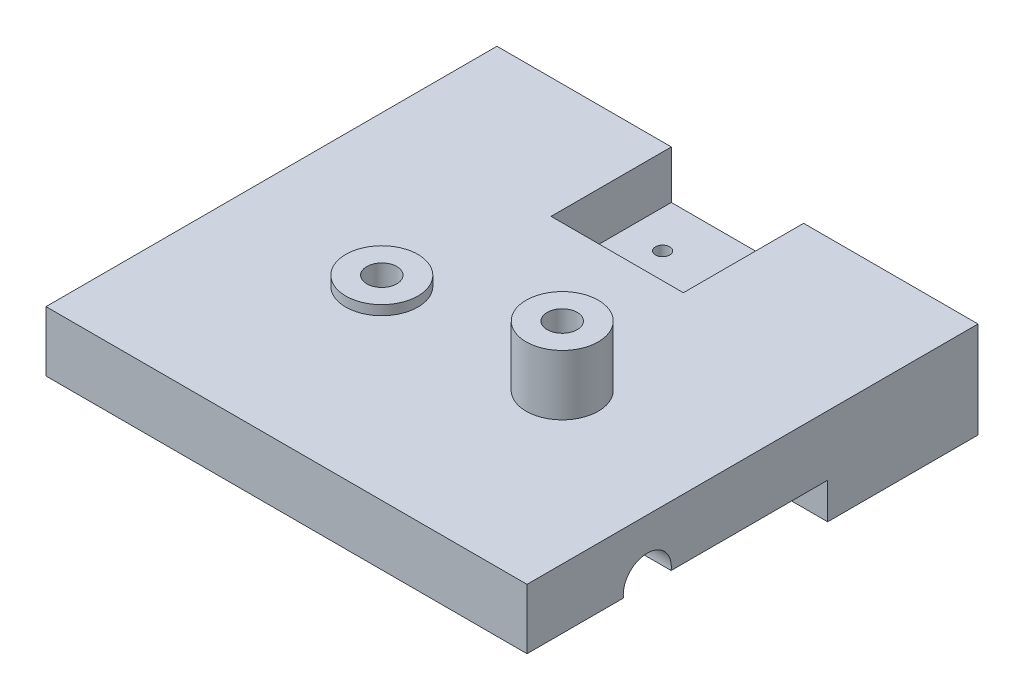
from build123d import *

# Parameters (mm, degrees)
SKETCH1_W               = 80
SKETCH1_H               = 50
BOSS_EXTRUDE1_DEPTH     = 10
SKETCH2_R               = 6.5
BOSS_EXTRUDE3_DEPTH     = 10
BOSS_EXTRUDE4_START     = 15
SKETCH3_R               = 6.5
BOSS_EXTRUDE4_DEPTH     = 15
SKETCH4_R               = 3.15
CUT_EXTRUDE1_DEPTH      = 40
SKETCH6_R               = 6
CUT_EXTRUDE3_DEPTH      = 9.75
CUT_EXTRUDE4_DEPTH      = 65.807406984
CUT_EXTRUDE4_DEPTH_BACK = 65.807406984
SKETCH14_R              = 4
SKETCH15_W              = 23.2
SKETCH15_H              = 10
SKETCH15_W_2            = 20.2
SKETCH15_H_2            = 6.8
BOSS_EXTRUDE5_DEPTH     = 15
SKETCH18_W              = 10
SKETCH18_H              = 10
BOSS_EXTRUDE6_DEPTH     = 80
BOSS_EXTRUDE8_START     = 15
SKETCH21_W              = 28.4
SKETCH21_H              = 16.534595494
SKETCH21_R              = 6.5
BOSS_EXTRUDE8_DEPTH     = 15
BOSS_EXTRUDE9_DEPTH     = 10
BOSS_EXTRUDE12_START    = 15
SKETCH23_W              = 28.4
SKETCH23_H              = 16.5
SKETCH23_R              = 3.15
BOSS_EXTRUDE12_DEPTH    = 15
BOSS_EXTRUDE13_DEPTH    = 10
SKETCH26_W              = 20.2
SKETCH26_H              = 6.8
BOSS_EXTRUDE15_DEPTH    = 15
CUT_EXTRUDE7_DEPTH      = 20
CUT_EXTRUDE8_DEPTH      = 16
SKETCH32_W              = 75
SKETCH32_H              = 2.556036438
CUT_EXTRUDE9_DEPTH      = 116.53
SKETCH38_R              = 1.185
CUT_EXTRUDE12_DEPTH     = 20
BOSS_EXTRUDE18_START    = -6
SKETCH39_W              = 23.2
SKETCH39_H              = 25
SKETCH39_R              = 1.185
SKETCH39_W_2            = 10
SKETCH39_H_2            = 4
BOSS_EXTRUDE18_DEPTH    = 6
SKETCH40_R              = 2.5
CUT_EXTRUDE13_DEPTH     = 20
SKETCH5_R               = 2.5
CUT_EXTRUDE14_DEPTH     = 77.25
BOSS_EXTRUDE20_START    = 10
SKETCH42_R              = 6
SKETCH42_R_2            = 2.5
BOSS_EXTRUDE20_DEPTH    = 10
BOSS_EXTRUDE21_START    = 1.6
SKETCH43_R              = 6
SKETCH43_R_2            = 2.5
BOSS_EXTRUDE21_DEPTH    = 1.6
BOSS_EXTRUDE22_START    = -10
SKETCH44_R              = 2.5
BOSS_EXTRUDE22_DEPTH    = 10
CUT_EXTRUDE15_DEPTH     = 2


with BuildPart() as part:
    # Sketch1 → Boss-Extrude1 (new body)
    with BuildSketch(Plane(origin=(0, 0, 0), x_dir=(1, 0, 0), z_dir=(0, 1, 0))):
        with Locations((40, -25)):
            Rectangle(SKETCH1_W, SKETCH1_H)
    extrude(amount=BOSS_EXTRUDE1_DEPTH)

    # Sketch2 → Boss-Extrude3 (add)
    with BuildSketch(Plane.XY):
        with Locations((14, 0)):
            Circle(SKETCH2_R)
        with Locations((66, 0)):
            Circle(SKETCH2_R)
    extrude(amount=BOSS_EXTRUDE3_DEPTH)

    # Sketch3 → Boss-Extrude4 (add)
    with BuildSketch(Plane(origin=(0, 0, 0), x_dir=(-1, 0, 0), z_dir=(0, 0, -1)).offset(BOSS_EXTRUDE4_START)):
        with Locations((-66, 0)):
            Circle(SKETCH3_R)
        with Locations((-14, 0)):
            Circle(SKETCH3_R)
    extrude(amount=-BOSS_EXTRUDE4_DEPTH)

    # Sketch4 → Cut-Extrude1 (cut)
    with BuildSketch(Plane(origin=(0, 0, -15), x_dir=(-1, 0, 0), z_dir=(0, 0, -1))):
        with Locations((-14, 0)):
            Circle(SKETCH4_R)
        with Locations((-66, 0)):
            Circle(SKETCH4_R)
    extrude(amount=-CUT_EXTRUDE1_DEPTH, mode=Mode.SUBTRACT)

    # Sketch6 → Cut-Extrude3 (cut, symmetric)
    with BuildSketch(Plane.ZY.offset(-40)):
        with Locations((40, 1)):
            Circle(SKETCH6_R)
    extrude(amount=CUT_EXTRUDE3_DEPTH, both=True, mode=Mode.SUBTRACT)

    # Sketch14 → Cut-Extrude4 (cut, two sides: drawn at the far end of the back side and taken through both)
    with BuildSketch(Plane.ZY.offset(-40).offset(-CUT_EXTRUDE4_DEPTH_BACK)):
        with Locations((40, 0.5)):
            Circle(SKETCH14_R)
    extrude(amount=CUT_EXTRUDE4_DEPTH + CUT_EXTRUDE4_DEPTH_BACK, mode=Mode.SUBTRACT)

    # Sketch15 → Boss-Extrude5 (add)
    with BuildSketch(Plane(origin=(0, 0, 0), x_dir=(-1, 0, 0), z_dir=(0, 0, -1))):
        with Locations((-40, 5)):
            Rectangle(SKETCH15_W, SKETCH15_H)
        with Locations((-40, 5)):
            Rectangle(SKETCH15_W_2, SKETCH15_H_2, mode=Mode.SUBTRACT)
    extrude(amount=BOSS_EXTRUDE5_DEPTH)

    # Sketch18 → Boss-Extrude6 (add)
    with BuildSketch(Plane.ZY):
        with Locations((55, 5)):
            Rectangle(SKETCH18_W, SKETCH18_H)
    extrude(amount=-BOSS_EXTRUDE6_DEPTH)

    # Sketch21 → Boss-Extrude8 (add)
    with BuildSketch(Plane(origin=(0, 0, 0), x_dir=(-1, 0, 0), z_dir=(0, 0, -1)).offset(BOSS_EXTRUDE8_START)):
        with Locations((-14.2, 1.732702253)):
            Rectangle(SKETCH21_W, SKETCH21_H)
        with Locations((-14, 0)):
            Circle(SKETCH21_R, mode=Mode.SUBTRACT)
    extrude(amount=-BOSS_EXTRUDE8_DEPTH)

    # Sketch22 → Boss-Extrude9 (add)
    with BuildSketch(Plane.XY):
        with BuildLine():
            Line((0, 0), (7.5, 0))
            ThreePointArc((7.5, 0), (14, -6.5), (20.5, 0))
            Line((20.5, 0), (28.4, 0))
            Line((28.4, 0), (28.4, -6.534595494))
            Line((28.4, -6.534595494), (0, -6.534595494))
            Line((0, -6.534595494), (0, 0))
        make_face()
    extrude(amount=BOSS_EXTRUDE9_DEPTH)

    # Sketch23 → Boss-Extrude12 (add)
    with BuildSketch(Plane(origin=(0, 0, 0), x_dir=(-1, 0, 0), z_dir=(0, 0, -1)).offset(BOSS_EXTRUDE12_START)):
        with Locations((-65.8, 1.75)):
            Rectangle(SKETCH23_W, SKETCH23_H)
        with Locations((-66, 0)):
            Circle(SKETCH23_R, mode=Mode.SUBTRACT)
    extrude(amount=-BOSS_EXTRUDE12_DEPTH)

    # Sketch24 → Boss-Extrude13 (add)
    with BuildSketch(Plane.XY):
        with BuildLine():
            ThreePointArc((72.5, 0), (70.596194078, -4.596194078), (66, -6.5))
            Line((66, -6.5), (80, -6.5))
            Line((80, -6.5), (80, 0))
            Line((80, 0), (72.5, 0))
        make_face()
        with BuildLine():
            Line((59.5, 0), (51.6, 0))
            Line((51.6, 0), (51.6, -6.5))
            Line((51.6, -6.5), (66, -6.5))
            ThreePointArc((66, -6.5), (61.403805922, -4.596194078), (59.5, 0))
        make_face()
    extrude(amount=BOSS_EXTRUDE13_DEPTH)

    # Sketch26 → Boss-Extrude15 (add)
    with BuildSketch(Plane(origin=(0, 0, 0), x_dir=(-1, 0, 0), z_dir=(0, 0, -1))):
        with Locations((-40, 5)):
            Rectangle(SKETCH26_W, SKETCH26_H)
    extrude(amount=BOSS_EXTRUDE15_DEPTH)

    # Sketch27 → Cut-Extrude7 (cut)
    with BuildSketch(Plane(origin=(0, 0, -15), x_dir=(-1, 0, 0), z_dir=(0, 0, -1))):
        Polygon((-51, 10), (-40, 10), (-29, 10), (-29, 2), (-51, 2), align=None)
    extrude(amount=-CUT_EXTRUDE7_DEPTH, mode=Mode.SUBTRACT)

    # Sketch30 → Cut-Extrude8 (cut)
    with BuildSketch(Plane(origin=(0, 2, 0), x_dir=(1, 0, 0), z_dir=(0, 1, 0))):
        Polygon((45, -5), (40, -5), (35, -5), (35, -1), (40, -1), (45, -1), align=None)
    extrude(amount=-CUT_EXTRUDE8_DEPTH, mode=Mode.SUBTRACT)

    # Sketch32 → Cut-Extrude9 (cut)
    with BuildSketch(Plane(origin=(80, 0, 0), x_dir=(0, 0, -1), z_dir=(1, 0, 0))):
        with Locations((-22.5, -7.278018219)):
            Rectangle(SKETCH32_W, SKETCH32_H)
    extrude(amount=-CUT_EXTRUDE9_DEPTH, mode=Mode.SUBTRACT)

    # Sketch38 → Cut-Extrude12 (cut)
    with BuildSketch(Plane(origin=(0, 2, 0), x_dir=(1, 0, 0), z_dir=(0, 1, 0))):
        with Locations((35.25, 7.3)):
            Circle(SKETCH38_R)
        with Locations((44.75, 7.3)):
            Circle(SKETCH38_R)
    extrude(amount=-CUT_EXTRUDE12_DEPTH, mode=Mode.SUBTRACT)

    # Sketch39 → Boss-Extrude18 (add)
    with BuildSketch(Plane.XZ.offset(6).offset(BOSS_EXTRUDE18_START)):
        with Locations((40, -2.5)):
            Rectangle(SKETCH39_W, SKETCH39_H)
        with Locations((35.25, -7.3)):
            Circle(SKETCH39_R, mode=Mode.SUBTRACT)
        with Locations((44.75, -7.3)):
            Circle(SKETCH39_R, mode=Mode.SUBTRACT)
        with Locations((40, 3)):
            Rectangle(SKETCH39_W_2, SKETCH39_H_2, mode=Mode.SUBTRACT)
    extrude(amount=BOSS_EXTRUDE18_DEPTH)

    # Sketch40 → Cut-Extrude13 (cut)
    with BuildSketch(Plane(origin=(0, 10, 0), x_dir=(1, 0, 0), z_dir=(0, 1, 0))):
        with Locations((25, -29.15)):
            Circle(SKETCH40_R)
        with Locations((55, -29.15)):
            Circle(SKETCH40_R)
    extrude(amount=-CUT_EXTRUDE13_DEPTH, mode=Mode.SUBTRACT)

    # Sketch5 → Cut-Extrude14 (cut)
    with BuildSketch(Plane.XZ):
        with Locations((25, 14)):
            Circle(SKETCH5_R)
        with Locations((55, 14)):
            Circle(SKETCH5_R)
    extrude(amount=-CUT_EXTRUDE14_DEPTH, mode=Mode.SUBTRACT)

    # Sketch42 → Boss-Extrude20 (add)
    with BuildSketch(Plane(origin=(0, 10, 0), x_dir=(1, 0, 0), z_dir=(0, 1, 0)).offset(BOSS_EXTRUDE20_START)):
        with Locations((55, -29.15)):
            Circle(SKETCH42_R)
        with Locations((55, -29.15)):
            Circle(SKETCH42_R_2, mode=Mode.SUBTRACT)
    extrude(amount=-BOSS_EXTRUDE20_DEPTH)

    # Sketch43 → Boss-Extrude21 (add)
    with BuildSketch(Plane(origin=(0, 10, 0), x_dir=(1, 0, 0), z_dir=(0, 1, 0)).offset(BOSS_EXTRUDE21_START)):
        with Locations((25, -29.15)):
            Circle(SKETCH43_R)
        with Locations((25, -29.15)):
            Circle(SKETCH43_R_2, mode=Mode.SUBTRACT)
    extrude(amount=-BOSS_EXTRUDE21_DEPTH)

    # Sketch44 → Boss-Extrude22 (add)
    with BuildSketch(Plane(origin=(0, 10, 0), x_dir=(1, 0, 0), z_dir=(0, 1, 0)).offset(BOSS_EXTRUDE22_START)):
        with Locations((25, -14)):
            Circle(SKETCH44_R)
        with Locations((55, -14)):
            Circle(SKETCH44_R)
    extrude(amount=BOSS_EXTRUDE22_DEPTH)

    # Sketch45 → Cut-Extrude15 (cut)
    # profile 1 of 2: a face of its own
    with BuildSketch(Plane.ZY):
        with BuildLine():
            Line((-12.541961952, -1.366127438), (-12.856064516, -1.366127438))
            add(Edge.make_bspline(
                [(-12.856064516, -1.366127438), (-12.854017363, -1.32445655), (-12.849996809, -1.242616035), (-12.83116852, -1.123292129), (-12.804227643, -1.00923733), (-12.766136189, -0.901367416), (-12.718829911, -0.798728609), (-12.662099884, -0.701728593), (-12.594906033, -0.610737405), (-12.518699299, -0.526598561), (-12.43593066, -0.449410991), (-12.346624721, -0.382755748), (-12.252779693, -0.326438076), (-12.154680294, -0.279356835), (-12.051219731, -0.244016989), (-11.943336873, -0.217795349), (-11.830557736, -0.202019003), (-11.753717714, -0.200323218), (-11.714638234, -0.199460771)],
                knots=[0, 0, 0, 0, 1.10065271, 2.161652631, 3.183658789, 4.190468796, 5.17591951, 6.163126047, 7.15150782, 8.156236427, 9.156009102, 10.134482811, 11.092018607, 12.041330605, 13.001268258, 13.972401359, 14.968799086, 16, 16, 16, 16], degree=3))
            add(Edge.make_bspline(
                [(-11.714638234, -0.199460771), (-11.67626016, -0.200359228), (-11.600848616, -0.202124662), (-11.490786601, -0.217285692), (-11.386009307, -0.241031283), (-11.28672154, -0.2743467), (-11.193715476, -0.319131127), (-11.106292431, -0.372928666), (-11.02341162, -0.435148497), (-10.948804837, -0.50840231), (-10.880296757, -0.586604695), (-10.821194502, -0.670092598), (-10.770581339, -0.756321884), (-10.728393659, -0.845950086), (-10.69733752, -0.939821114), (-10.673759312, -1.036568317), (-10.660431898, -1.137193128), (-10.658386475, -1.205299684), (-10.657346568, -1.239925515)],
                knots=[0, 0, 0, 0, 1.111607364, 2.184268762, 3.212621178, 4.221274766, 5.211760367, 6.196651075, 7.1921475, 8.207485113, 9.220403448, 10.201281604, 11.166441695, 12.114753415, 13.065576456, 14.026450734, 14.996634279, 16, 16, 16, 16], degree=3))
            add(Edge.make_bspline(
                [(-10.657346568, -1.239925515), (-10.65903983, -1.288673349), (-10.662396642, -1.385313563), (-10.691111018, -1.527328426), (-10.735957529, -1.664921845), (-10.789954886, -1.775659147), (-10.84442733, -1.864892641), (-10.893514838, -1.938361345), (-10.950979649, -2.017466814), (-11.017658147, -2.101944151), (-11.092171019, -2.192455056), (-11.175193182, -2.288944852), (-11.267316664, -2.390416622), (-11.331975165, -2.459722223), (-11.36547958, -2.495634649)],
                knots=[0, 0, 0, 0, 1.184426356, 2.348067706, 3.509069118, 4.696110526, 5.333549288, 6.050745305, 6.844228056, 7.710549037, 8.667450064, 9.695053472, 10.805634456, 12, 12, 12, 12], degree=3))
            Line((-11.36547958, -2.495634649), (-12.241180702, -3.430230002))
            Line((-12.241180702, -3.430230002), (-10.612474773, -3.430230002))
            Line((-10.612474773, -3.430230002), (-10.612474773, -3.789204361))
            Line((-10.612474773, -3.789204361), (-12.990679901, -3.789204361))
            Line((-12.990679901, -3.789204361), (-11.633308106, -2.340686733))
            add(Edge.make_bspline(
                [(-11.633308106, -2.340686733), (-11.600260219, -2.306188426), (-11.536781992, -2.239924239), (-11.446999415, -2.143181279), (-11.366360427, -2.053431739), (-11.294343034, -1.97084519), (-11.232509529, -1.894213622), (-11.177637297, -1.826018919), (-11.133671706, -1.763264468), (-11.08595631, -1.690523855), (-11.039742329, -1.601711537), (-11.000029973, -1.493177848), (-10.975815124, -1.381450595), (-10.972910289, -1.305948558), (-10.971449132, -1.267970386)],
                knots=[0, 0, 0, 0, 1.329631726, 2.553950428, 3.673215718, 4.687767853, 5.603093632, 6.413772471, 7.123043292, 7.734684054, 8.834405432, 9.900288307, 10.943827018, 12, 12, 12, 12], degree=3))
            add(Edge.make_bspline(
                [(-10.971449132, -1.267970386), (-10.972084874, -1.244088988), (-10.9733378, -1.197023338), (-10.984395497, -1.128017579), (-11.001106004, -1.061452765), (-11.025051262, -0.997124146), (-11.056658002, -0.935678494), (-11.095131382, -0.877041013), (-11.139521445, -0.820352048), (-11.190872714, -0.76719875), (-11.247284234, -0.718517545), (-11.306878484, -0.675393459), (-11.369928588, -0.639354348), (-11.43616871, -0.609810851), (-11.50541418, -0.58663547), (-11.577798925, -0.570576891), (-11.653122941, -0.560494407), (-11.704556437, -0.559130235), (-11.730764036, -0.55843513)],
                knots=[0, 0, 0, 0, 0.991446411, 1.95395049, 2.89581595, 3.838931463, 4.798493298, 5.75982156, 6.748411868, 7.785213223, 8.824556874, 9.840280684, 10.836137867, 11.835679398, 12.848801643, 13.863922112, 14.911575587, 16, 16, 16, 16], degree=3))
            add(Edge.make_bspline(
                [(-11.730764036, -0.55843513), (-11.758134868, -0.559150162), (-11.811886665, -0.560554368), (-11.890805697, -0.570377032), (-11.966091475, -0.587322872), (-12.037933378, -0.610499546), (-12.106452964, -0.639958095), (-12.171317008, -0.67664984), (-12.232379897, -0.720433333), (-12.28975642, -0.770073889), (-12.342620399, -0.825341491), (-12.389067275, -0.886951454), (-12.429651289, -0.953778869), (-12.465060523, -1.02564342), (-12.493816213, -1.1031972), (-12.515789363, -1.186164904), (-12.53317621, -1.274186286), (-12.538984731, -1.334971371), (-12.541961952, -1.366127438)],
                knots=[0, 0, 0, 0, 1.031018746, 2.02475058, 2.990194455, 3.934040569, 4.864654155, 5.795059489, 6.735614925, 7.690564532, 8.649604399, 9.611025574, 10.590972636, 11.591080095, 12.624614302, 13.701020113, 14.821632451, 16, 16, 16, 16], degree=3))
        make_face()
    # profile 2 of 2: a face of its own
    with BuildSketch(Plane.ZY):
        with BuildLine():
            Line((-9.535551696, -3.878947951), (-9.786553298, -3.704368624))
            Line((-9.786553298, -3.704368624), (-8.813396247, -2.281792502))
            add(Edge.make_bspline(
                [(-8.813396247, -2.281792502), (-8.875486983, -2.289385565), (-8.997747103, -2.30433673), (-9.120884205, -2.307083385), (-9.181485189, -2.30843513)],
                knots=[0, 0, 0, 0, 1.015715272, 2, 2, 2, 2], degree=3))
            add(Edge.make_bspline(
                [(-9.181485189, -2.30843513), (-9.218227237, -2.307494054), (-9.290348664, -2.305646803), (-9.396380317, -2.291004994), (-9.498265877, -2.268454867), (-9.595735233, -2.234806112), (-9.689154738, -2.192987903), (-9.778320451, -2.141130889), (-9.863112342, -2.080124597), (-9.942619752, -2.010291606), (-10.014931491, -1.933613553), (-10.079354788, -1.85245791), (-10.13289592, -1.76588194), (-10.177372506, -1.67565172), (-10.211102959, -1.580470369), (-10.235665497, -1.481420969), (-10.250787851, -1.377809327), (-10.252586947, -1.307284197), (-10.253500414, -1.271475995)],
                knots=[0, 0, 0, 0, 1.060718605, 2.082097864, 3.085795603, 4.069760067, 5.054557537, 6.03741023, 7.043284206, 8.066802108, 9.088538119, 10.083643548, 11.053783639, 12.022749082, 12.983451788, 13.964007469, 14.966251758, 16, 16, 16, 16], degree=3))
            add(Edge.make_bspline(
                [(-10.253500414, -1.271475995), (-10.251765979, -1.222507343), (-10.248361635, -1.126391811), (-10.220963118, -0.985958042), (-10.175902779, -0.853171499), (-10.113074402, -0.728381305), (-10.033939681, -0.613382565), (-9.938831091, -0.509773956), (-9.828327126, -0.419029102), (-9.704945107, -0.341025025), (-9.571592086, -0.278290028), (-9.431923428, -0.232050727), (-9.287009308, -0.204851979), (-9.188841638, -0.201266118), (-9.139417882, -0.199460771)],
                knots=[0, 0, 0, 0, 1.022988612, 2.007919123, 2.978103895, 3.94594894, 4.918897164, 5.887013414, 6.875921846, 7.89917871, 8.930658928, 9.948724884, 10.967259574, 12, 12, 12, 12], degree=3))
            add(Edge.make_bspline(
                [(-9.139417882, -0.199460771), (-9.090929462, -0.201290934), (-8.995120915, -0.204907164), (-8.854231909, -0.231391133), (-8.719290892, -0.276027806), (-8.591045905, -0.337712369), (-8.472306493, -0.415033277), (-8.365530682, -0.507167801), (-8.273155143, -0.614173328), (-8.195331262, -0.733461818), (-8.132861222, -0.861628799), (-8.087788939, -0.995412722), (-8.0600433, -1.133851443), (-8.056546972, -1.227645917), (-8.054782465, -1.274981604)],
                knots=[0, 0, 0, 0, 1.026385292, 2.028040595, 3.023318987, 4.028184125, 5.03290303, 6.015178782, 7.004435299, 8.016004309, 9.023023918, 10.015172535, 10.998308025, 12, 12, 12, 12], degree=3))
            add(Edge.make_bspline(
                [(-8.054782465, -1.274981604), (-8.055960874, -1.311725372), (-8.058350982, -1.386250912), (-8.075087289, -1.499481255), (-8.103507474, -1.614932485), (-8.135759173, -1.71265408), (-8.16689134, -1.79336253), (-8.196192472, -1.85711411), (-8.228704626, -1.924215373), (-8.266623391, -1.993962711), (-8.307385688, -2.067245246), (-8.353444964, -2.143327962), (-8.403750536, -2.222312955), (-8.439580256, -2.275560043), (-8.457927497, -2.302826156)],
                knots=[0, 0, 0, 0, 1.179839688, 2.393009684, 3.667231171, 4.993948276, 5.694988576, 6.444077775, 7.246288328, 8.089075292, 8.993003841, 9.939041771, 10.944649915, 12, 12, 12, 12], degree=3))
            Line((-8.457927497, -2.302826156), (-9.535551696, -3.878947951))
        make_face()
        with BuildLine():
            add(Edge.make_bspline(
                [(-9.12329208, -1.949460771), (-9.095458066, -1.948700387), (-9.041274703, -1.947220179), (-8.961897404, -1.938210937), (-8.886973201, -1.922236951), (-8.816301951, -1.899317239), (-8.74917505, -1.87166057), (-8.686658721, -1.836448584), (-8.628700646, -1.794431949), (-8.574912719, -1.747221933), (-8.527148719, -1.694771349), (-8.484605689, -1.639874243), (-8.448445121, -1.582289633), (-8.419881844, -1.521296371), (-8.396397269, -1.458379162), (-8.380179257, -1.392524807), (-8.371194923, -1.324076406), (-8.369663348, -1.277577748), (-8.368885029, -1.253947951)],
                knots=[0, 0, 0, 0, 1.163407946, 2.26475976, 3.333800367, 4.359385343, 5.366239384, 6.363380779, 7.350133999, 8.353570782, 9.349036268, 10.310270964, 11.253520213, 12.184142, 13.120487599, 14.056272588, 15.012232024, 16, 16, 16, 16], degree=3))
            add(Edge.make_bspline(
                [(-8.368885029, -1.253947951), (-8.369554698, -1.230308285), (-8.370874364, -1.183723425), (-8.381461663, -1.115173685), (-8.400086886, -1.049480425), (-8.425077371, -0.986283995), (-8.457997609, -0.926103623), (-8.497501095, -0.868183751), (-8.544433544, -0.812891623), (-8.598436111, -0.76152764), (-8.656670664, -0.71417974), (-8.718731164, -0.672393664), (-8.78410608, -0.637372468), (-8.85239657, -0.608473498), (-8.923744919, -0.585921723), (-8.998108907, -0.569704358), (-9.075864312, -0.560732603), (-9.128645599, -0.559210709), (-9.155543683, -0.55843513)],
                knots=[0, 0, 0, 0, 0.972161553, 1.915763587, 2.844109794, 3.775983486, 4.705125789, 5.659731448, 6.655561913, 7.682237399, 8.721216875, 9.739758359, 10.754845918, 11.767244016, 12.7857855, 13.828538656, 14.893392813, 16, 16, 16, 16], degree=3))
            add(Edge.make_bspline(
                [(-9.155543683, -0.55843513), (-9.182207836, -0.559211962), (-9.234522686, -0.560736099), (-9.311586845, -0.569687304), (-9.385448013, -0.586030788), (-9.456589633, -0.608463052), (-9.524878094, -0.637374624), (-9.590249927, -0.6723955), (-9.652324943, -0.714170122), (-9.710503664, -0.761564894), (-9.764601586, -0.81265254), (-9.810727115, -0.868425969), (-9.850321007, -0.926073494), (-9.88319601, -0.986292002), (-9.908198527, -1.049478288), (-9.926820529, -1.115174264), (-9.937408694, -1.183723274), (-9.938728241, -1.230308235), (-9.93939785, -1.253947951)],
                knots=[0, 0, 0, 0, 1.099389452, 2.15699305, 3.192601482, 4.213358962, 5.227959689, 6.245255729, 7.266013209, 8.307253147, 9.336162325, 10.327954924, 11.284637477, 12.215801273, 13.149702402, 14.080068371, 15.025723358, 16, 16, 16, 16], degree=3))
            add(Edge.make_bspline(
                [(-9.93939785, -1.253947951), (-9.938791924, -1.277596149), (-9.937596926, -1.324234725), (-9.926069137, -1.392761118), (-9.906790857, -1.458449312), (-9.880971466, -1.521938019), (-9.846969876, -1.582609877), (-9.805246028, -1.640177239), (-9.756340482, -1.69529269), (-9.700906994, -1.747099901), (-9.640238833, -1.794652077), (-9.575442087, -1.836182459), (-9.50763225, -1.871254903), (-9.43657062, -1.899396287), (-9.36278382, -1.922007951), (-9.285608688, -1.938181496), (-9.205300451, -1.947133763), (-9.150890469, -1.94867766), (-9.12329208, -1.949460771)],
                knots=[0, 0, 0, 0, 0.952633368, 1.87876736, 2.791047057, 3.707742249, 4.635551637, 5.587206343, 6.568248508, 7.601284464, 8.641511608, 9.671105535, 10.699146789, 11.713763218, 12.747829548, 13.806491675, 14.887386225, 16, 16, 16, 16], degree=3))
        make_face(mode=Mode.SUBTRACT)
    extrude(amount=-CUT_EXTRUDE15_DEPTH, mode=Mode.SUBTRACT)


solid = part.part
